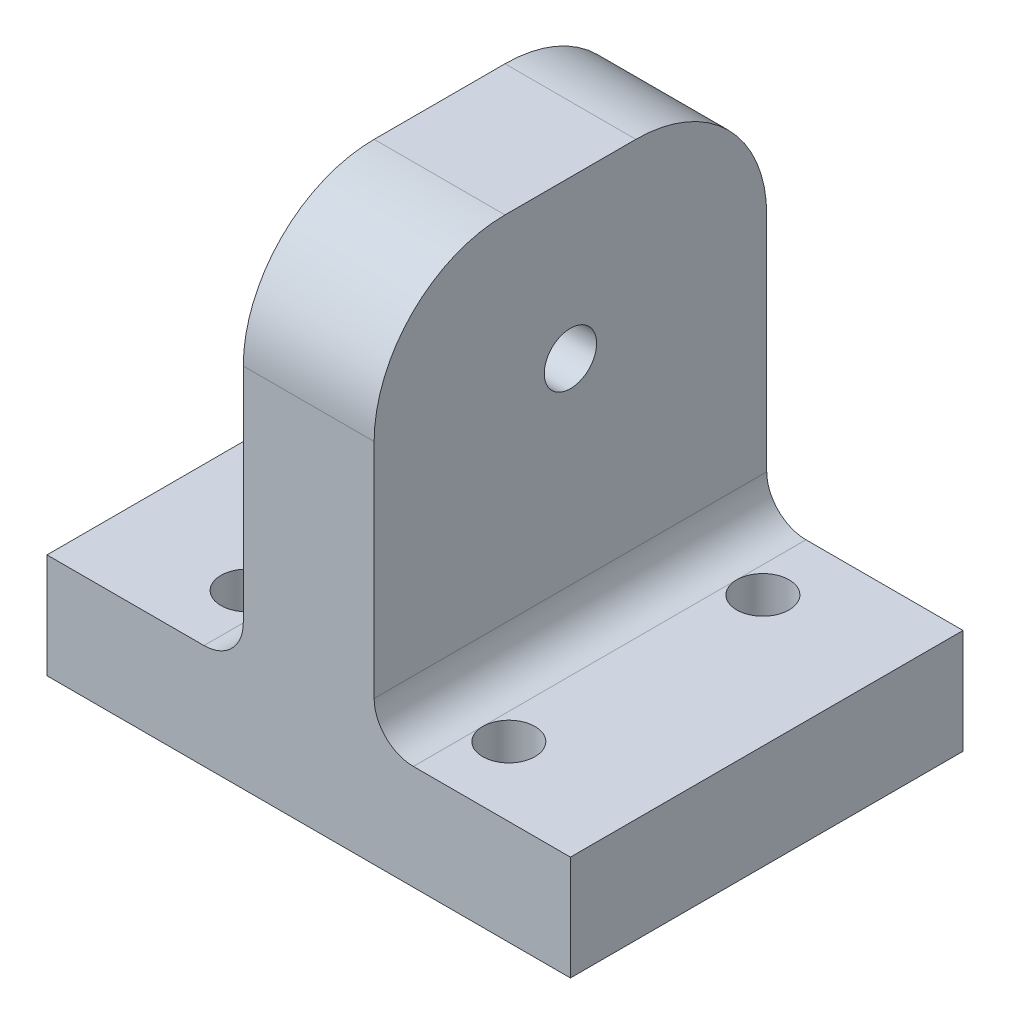
from build123d import *

# Parameters (mm, degrees)
SKETCH1_W           = 40
SKETCH1_H           = 30
BOSS_EXTRUDE1_DEPTH = 8
SKETCH2_W           = 10
SKETCH2_H           = 30
BOSS_EXTRUDE2_DEPTH = 30
FILLET2_R           = 3
SKETCH3_R           = 2
CUT_EXTRUDE1_DEPTH  = 30
SKETCH4_R           = 2
CUT_EXTRUDE2_DEPTH  = 10
FILLET3_R           = 10


with BuildPart() as part:
    # Sketch1 → Boss-Extrude1 (new body)
    with BuildSketch(Plane(origin=(0, 0, 0), x_dir=(1, 0, 0), z_dir=(0, 1, 0))):
        Rectangle(SKETCH1_W, SKETCH1_H)
    extrude(amount=BOSS_EXTRUDE1_DEPTH)

    # Sketch2 → Boss-Extrude2 (add)
    with BuildSketch(Plane(origin=(0, 8, 0), x_dir=(1, 0, 0), z_dir=(0, 1, 0))):
        Rectangle(SKETCH2_W, SKETCH2_H)
    extrude(amount=BOSS_EXTRUDE2_DEPTH)

    # Fillet2
    fillet2_edges = [part.edges().sort_by_distance(p)[0] for p in [
        (5, 8, 0),
        (-5, 8, 0),
    ]]
    fillet(fillet2_edges, radius=FILLET2_R)

    # Sketch3 → Cut-Extrude1 (cut)
    with BuildSketch(Plane.XZ):
        with Locations(Location((-10, 9.706832571, 0), (0, 0, 270))):
            Circle(SKETCH3_R)
        with Locations(Location((10, 9.706832571, 0), (0, 0, 180))):
            Circle(SKETCH3_R)
        with Locations(Location((10, -9.706832571, 0), (0, 0, 270))):
            Circle(SKETCH3_R)
        with Locations((-10, -9.706832571)):
            Circle(SKETCH3_R)
    extrude(amount=-CUT_EXTRUDE1_DEPTH, mode=Mode.SUBTRACT)

    # Sketch4 → Cut-Extrude2 (cut)
    with BuildSketch(Plane(origin=(5, 0, 0), x_dir=(0, 0, -1), z_dir=(1, 0, 0))):
        with Locations((0, 26)):
            Circle(SKETCH4_R)
    extrude(amount=-CUT_EXTRUDE2_DEPTH, mode=Mode.SUBTRACT)

    # Fillet3
    fillet3_edges = [part.edges().sort_by_distance(p)[0] for p in [
        (0, 38, -15),
        (0, 38, 15),
    ]]
    fillet(fillet3_edges, radius=FILLET3_R)


solid = part.part
